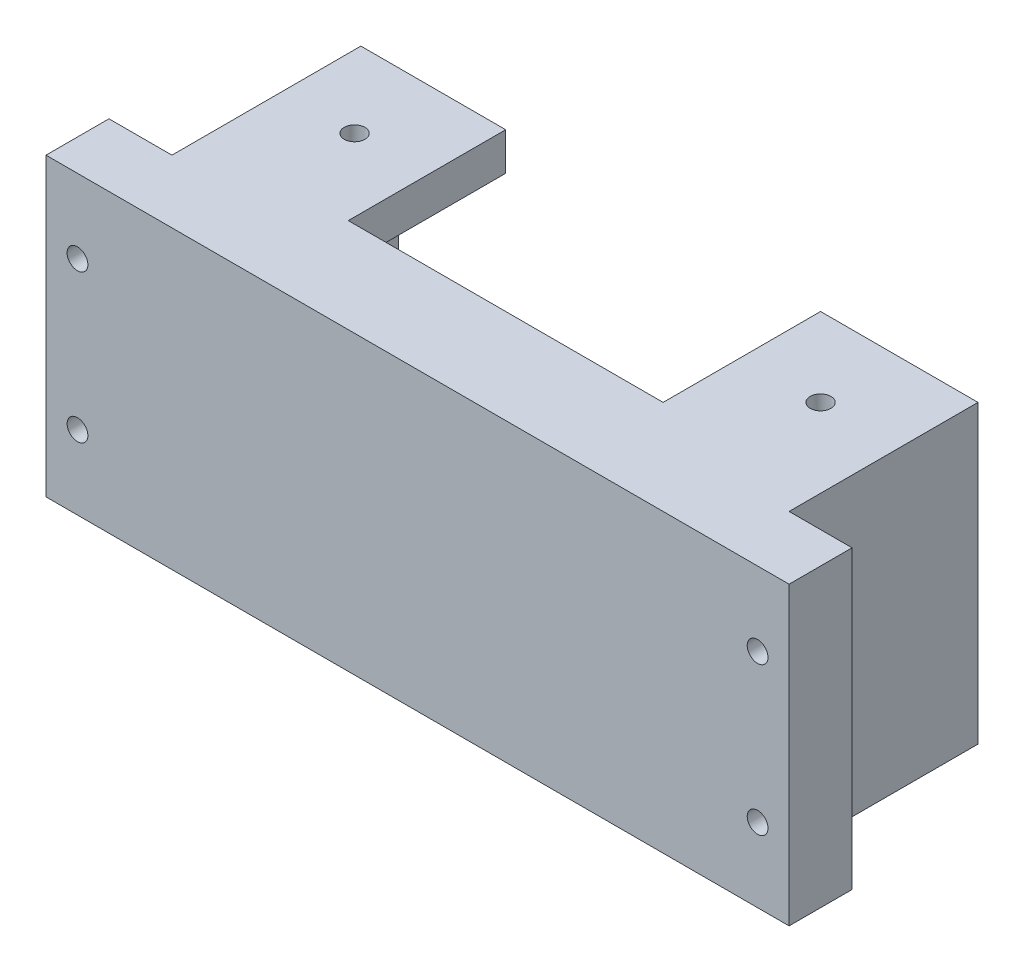
from build123d import *

# Parameters (mm, degrees)
BOSS_EXTRUDE2_DEPTH    = 75
SKETCH3_W              = 20
SKETCH3_H              = 10
BOSS_EXTRUDE3_DEPTH    = 75
SKETCH4_W              = 50
SKETCH4_H              = 25
CUT_EXTRUDE1_DEPTH     = 75
SKETCH5_W              = 50
SKETCH5_H              = 28
CUT_EXTRUDE2_DEPTH     = 75
SKETCH6_W              = 19
SKETCH6_H              = 35
CUT_EXTRUDE3_DEPTH     = 25
CUT_EXTRUDE4_DEPTH     = 14
CUT_EXTRUDE5_DEPTH     = 14
SKETCH24_W             = 50
SKETCH24_H             = 10
BOSS_EXTRUDE4_DEPTH    = 6
SKETCH25_W             = 50
SKETCH25_H             = 10
BOSS_EXTRUDE5_DEPTH    = 6
CUT_EXTRUDE7_DEPTH     = 143.751532391
SKETCH33_W             = 10
SKETCH33_H             = 10
BOSS_EXTRUDE6_DEPTH    = 47
M4X0_7_TAPPED_HOLE8_D  = 3.3
M4X0_7_TAPPED_HOLE9_D  = 3.3
M4X0_7_TAPPED_HOLE10_D = 3.3
M4X0_7_TAPPED_HOLE11_D = 3.3
BOSS_EXTRUDE7_DEPTH    = 10
BOSS_EXTRUDE8_DEPTH    = 10
M4X0_7_TAPPED_HOLE12_D = 3.3
M4X0_7_TAPPED_HOLE13_D = 3.3


with BuildPart() as part:
    # Sketch2 → Boss-Extrude2 (new body)
    with BuildSketch(Plane(origin=(0, 0, 0), x_dir=(1, 0, 0), z_dir=(0, 1, 0))):
        Polygon((-6, 69), (-6, 0), (-6, -6), (0, -6), (86, -6), (92, -6), (92, 0), (92, 69), (92, 75), (86, 75), (0, 75), (-6, 75), align=None)
    extrude(amount=BOSS_EXTRUDE2_DEPTH)

    # Sketch3 → Boss-Extrude3 (add)
    with BuildSketch(Plane(origin=(0, 0, 0), x_dir=(-1, 0, 0), z_dir=(0, -1, 0))):
        with Locations((-102, -1)):
            Rectangle(SKETCH3_W, SKETCH3_H)
        with Locations((16, -1)):
            Rectangle(SKETCH3_W, SKETCH3_H)
    extrude(amount=-BOSS_EXTRUDE3_DEPTH)

    # Sketch4 → Cut-Extrude1 (cut)
    with BuildSketch(Plane(origin=(0, 0, 0), x_dir=(-1, 0, 0), z_dir=(0, -1, 0))):
        with Locations((-42, 62.5)):
            Rectangle(SKETCH4_W, SKETCH4_H)
    extrude(amount=-CUT_EXTRUDE1_DEPTH, mode=Mode.SUBTRACT)

    # Sketch5 → Cut-Extrude2 (cut)
    with BuildSketch(Plane(origin=(0, 0, 0), x_dir=(-1, 0, 0), z_dir=(0, -1, 0))):
        with Locations((-42, 8)):
            Rectangle(SKETCH5_W, SKETCH5_H)
    extrude(amount=-CUT_EXTRUDE2_DEPTH, mode=Mode.SUBTRACT)

    # Sketch6 → Cut-Extrude3 (cut)
    with BuildSketch(Plane(origin=(0, 0, -75), x_dir=(-1, 0, 0), z_dir=(0, 0, -1))):
        with Locations((-76.5, 37.5)):
            Rectangle(SKETCH6_W, SKETCH6_H)
        Polygon((-67, 55), (-67, 20), (0, 20), (0, 37.5), (0, 55), align=None)
    extrude(amount=-CUT_EXTRUDE3_DEPTH, mode=Mode.SUBTRACT)

    # Sketch7 → Cut-Extrude4 (cut)
    with BuildSketch(Plane(origin=(0, 0, 0), x_dir=(-1, 0, 0), z_dir=(0, -1, 0))):
        Polygon((-112, 4), (-112, -6), (-67, -6), (-67, 22), (-17, 22), (-17, -6), (26, -6), (26, 4), (6, 4), (6, 75), (-17, 75), (-17, 50), (-67, 50), (-67, 75), (-92, 75), (-92, 4), align=None)
    extrude(amount=-CUT_EXTRUDE4_DEPTH, mode=Mode.SUBTRACT)

    # Sketch8 → Cut-Extrude5 (cut)
    with BuildSketch(Plane(origin=(0, 75, 0), x_dir=(1, 0, 0), z_dir=(0, 1, 0))):
        Polygon((-26, 4), (-6, 4), (-6, 75), (17, 75), (17, 50), (67, 50), (67, 75), (92, 75), (92, 4), (112, 4), (112, -6), (67, -6), (67, 22), (17, 22), (17, -6), (-26, -6), align=None)
    extrude(amount=-CUT_EXTRUDE5_DEPTH, mode=Mode.SUBTRACT)

    # Sketch24 → Boss-Extrude4 (add)
    with BuildSketch(Plane(origin=(0, 14, 0), x_dir=(-1, 0, 0), z_dir=(0, -1, 0))):
        with Locations((-42, 55)):
            Rectangle(SKETCH24_W, SKETCH24_H)
    extrude(amount=-BOSS_EXTRUDE4_DEPTH)

    # Sketch25 → Boss-Extrude5 (add)
    with BuildSketch(Plane(origin=(0, 61, 0), x_dir=(1, 0, 0), z_dir=(0, 1, 0))):
        with Locations((42, 55)):
            Rectangle(SKETCH25_W, SKETCH25_H)
    extrude(amount=-BOSS_EXTRUDE5_DEPTH)

    # Sketch31 → Cut-Extrude7 (cut, through all)
    with BuildSketch(Plane(origin=(0, 61, 0), x_dir=(1, 0, 0), z_dir=(0, 1, 0))):
        Polygon((-6, 45), (92, 45), (112, 45), (112, -6), (92, -6), (-6, -6), (-26, -6), (-26, 45), align=None)
    extrude(amount=-CUT_EXTRUDE7_DEPTH, mode=Mode.SUBTRACT)

    # Sketch33 → Boss-Extrude6 (add, through all)
    with BuildSketch(Plane(origin=(0, 61, 0), x_dir=(1, 0, 0), z_dir=(0, 1, 0))):
        with Locations((-11, 50)):
            Rectangle(SKETCH33_W, SKETCH33_H)
        with Locations((97, 50)):
            Rectangle(SKETCH33_W, SKETCH33_H)
    extrude(amount=-BOSS_EXTRUDE6_DEPTH)

    # M4x0.7 Tapped Hole8 (through all)
    with Locations(Plane(origin=(0, 0, -55), x_dir=(-1, 0, 0), z_dir=(0, 0, -1))):
        with Locations((11, 25.75)):
            Hole(M4X0_7_TAPPED_HOLE8_D / 2)

    # M4x0.7 Tapped Hole9 (through all)
    with Locations(Plane(origin=(0, 0, -55), x_dir=(-1, 0, 0), z_dir=(0, 0, -1))):
        with Locations((11, 49.25)):
            Hole(M4X0_7_TAPPED_HOLE9_D / 2)

    # M4x0.7 Tapped Hole10 (through all)
    with Locations(Plane(origin=(0, 0, -55), x_dir=(-1, 0, 0), z_dir=(0, 0, -1))):
        with Locations((-97, 49.25)):
            Hole(M4X0_7_TAPPED_HOLE10_D / 2)

    # M4x0.7 Tapped Hole11 (through all)
    with Locations(Plane(origin=(0, 0, -55), x_dir=(-1, 0, 0), z_dir=(0, 0, -1))):
        with Locations((-97, 25.75)):
            Hole(M4X0_7_TAPPED_HOLE11_D / 2)

    # Sketch44 → Boss-Extrude7 (add)
    with BuildSketch(Plane(origin=(0, 20, -75), x_dir=(-1, 0, 0), z_dir=(0, 0, -1))):
        Polygon((-17, -6), (-17, 0), (0, 0), (0, 35), (-17, 35), (-17, 41), (6, 41), (6, -6), align=None)
    extrude(amount=BOSS_EXTRUDE7_DEPTH)

    # Sketch45 → Boss-Extrude8 (add)
    with BuildSketch(Plane(origin=(0, 0, -75), x_dir=(-1, 0, 0), z_dir=(0, 0, -1))):
        Polygon((-67, 61), (-67, 55), (-86, 55), (-86, 20), (-67, 20), (-67, 14), (-92, 14), (-92, 61), align=None)
    extrude(amount=BOSS_EXTRUDE8_DEPTH)

    # M4x0.7 Tapped Hole12 (through all)
    with Locations(Plane(origin=(0, 61, 0), x_dir=(1, 0, 0), z_dir=(0, 1, 0))):
        with Locations((5.5, 72.5)):
            Hole(M4X0_7_TAPPED_HOLE12_D / 2)

    # M4x0.7 Tapped Hole13 (through all)
    with Locations(Plane(origin=(0, 61, 0), x_dir=(1, 0, 0), z_dir=(0, 1, 0))):
        with Locations((79.5, 72.5)):
            Hole(M4X0_7_TAPPED_HOLE13_D / 2)


solid = part.part
